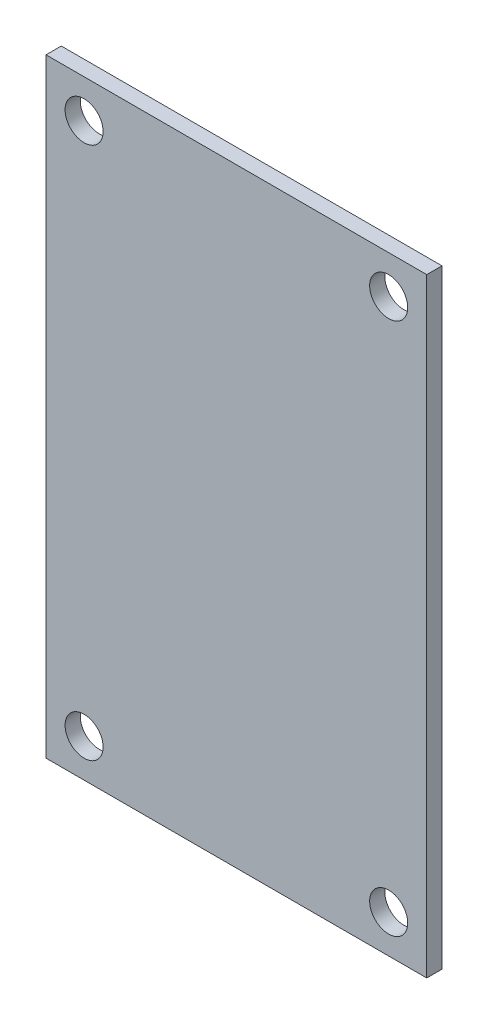
from build123d import *

# Parameters (mm, degrees)
SKETCH1_W           = 5
SKETCH1_H           = 8
SKETCH1_R           = 0.25
BOSS_EXTRUDE1_DEPTH = 0.2


with BuildPart() as part:
    # Sketch1 → Boss-Extrude1 (new body)
    with BuildSketch(Plane.XY):
        with Locations((2.5, 4)):
            Rectangle(SKETCH1_W, SKETCH1_H)
        with Locations((0.5, 0.5)):
            Circle(SKETCH1_R, mode=Mode.SUBTRACT)
        with Locations((4.5, 0.5)):
            Circle(SKETCH1_R, mode=Mode.SUBTRACT)
        with Locations((0.5, 7.5)):
            Circle(SKETCH1_R, mode=Mode.SUBTRACT)
        with Locations((4.5, 7.5)):
            Circle(SKETCH1_R, mode=Mode.SUBTRACT)
    extrude(amount=BOSS_EXTRUDE1_DEPTH)


solid = part.part
